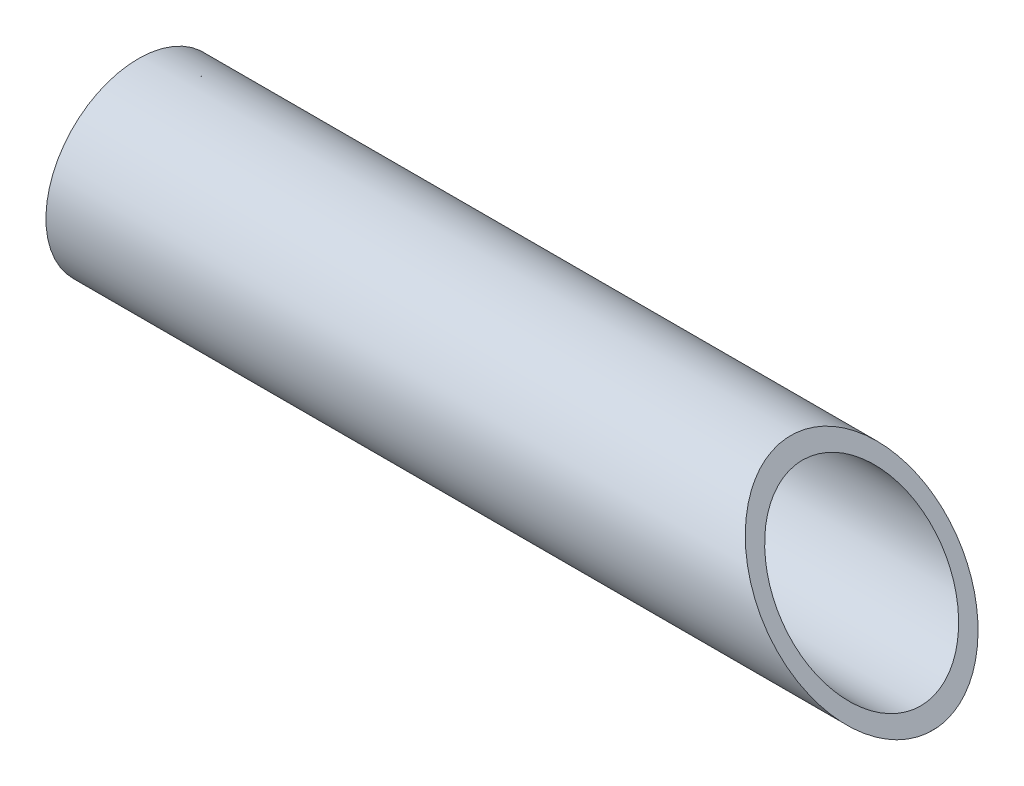
from build123d import *

# Parameters (mm, degrees)
SKETCH1_R           = 30
SKETCH1_R_2         = 25
BOSS_EXTRUDE1_DEPTH = 258
CUT_EXTRUDE1_DEPTH  = 129


with BuildPart() as part:
    # Sketch1 → Boss-Extrude1 (new body)
    with BuildSketch(Plane(origin=(0, 0, 0), x_dir=(0, 0, -1), z_dir=(1, 0, 0))):
        Circle(SKETCH1_R)
        Circle(SKETCH1_R_2, mode=Mode.SUBTRACT)
    extrude(amount=BOSS_EXTRUDE1_DEPTH)

    # Sketch2 → Cut-Extrude1 (cut, symmetric)
    with BuildSketch(Plane.XY):
        Polygon((212, 30), (266.843611736, -41.473586353), (269.863887228, 30), align=None)
    extrude(amount=CUT_EXTRUDE1_DEPTH, both=True, mode=Mode.SUBTRACT)


solid = part.part
